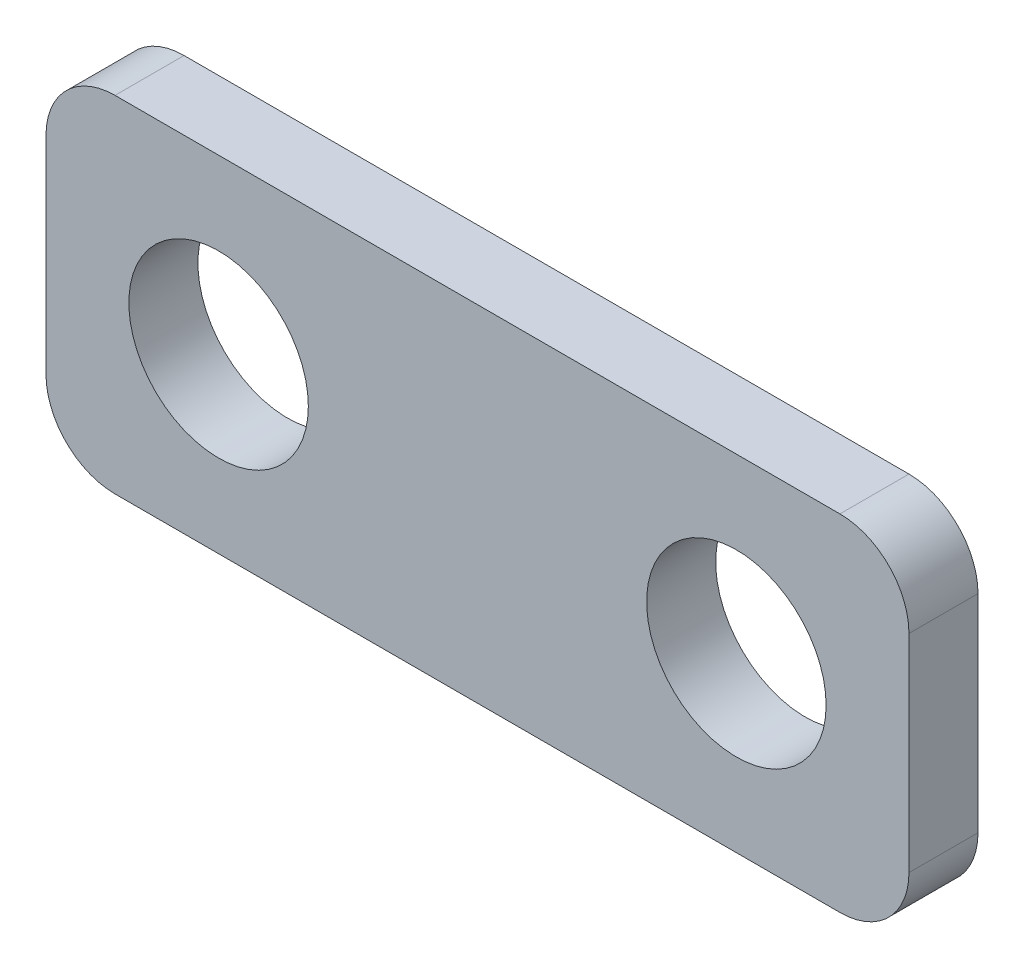
from build123d import *

# Parameters (mm, degrees)
SKETCH1_R           = 3.302
BOSS_EXTRUDE1_DEPTH = 2.54


with BuildPart() as part:
    # Sketch1 → Boss-Extrude1 (new body)
    with BuildSketch(Plane.XY):
        with BuildLine():
            Line((2.54, 0), (29.21, 0))
            ThreePointArc((29.21, 0), (31.006051224, 0.743948776), (31.75, 2.54))
            Line((31.75, 2.54), (31.75, 10.16))
            ThreePointArc((31.75, 10.16), (31.006051224, 11.956051224), (29.21, 12.7))
            Line((29.21, 12.7), (2.54, 12.7))
            ThreePointArc((2.54, 12.7), (0.743948776, 11.956051224), (0, 10.16))
            Line((0, 10.16), (0, 2.54))
            ThreePointArc((0, 2.54), (0.743948776, 0.743948776), (2.54, 0))
        make_face()
        with Locations((6.35, 6.35)):
            Circle(SKETCH1_R, mode=Mode.SUBTRACT)
        with Locations((25.4, 6.35)):
            Circle(SKETCH1_R, mode=Mode.SUBTRACT)
    extrude(amount=BOSS_EXTRUDE1_DEPTH)


solid = part.part
